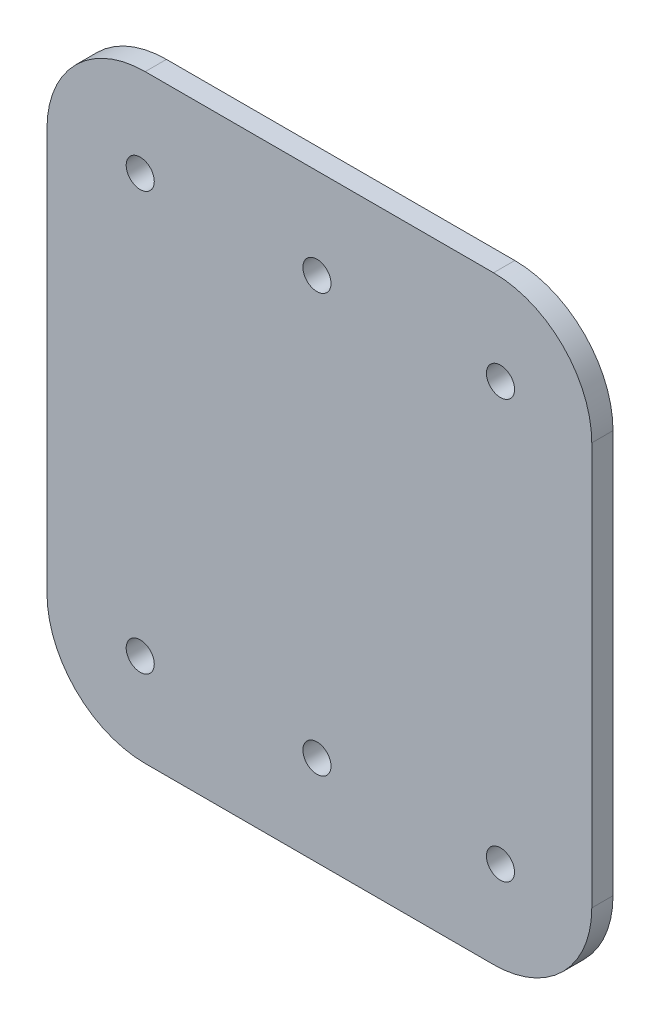
from build123d import *

# Parameters (mm, degrees)
SKETCH1_R           = 2.1
BOSS_EXTRUDE1_DEPTH = 3.175


with BuildPart() as part:
    # Sketch1 → Boss-Extrude1 (new body)
    with BuildSketch(Plane.XY):
        with BuildLine():
            Line((11.353799985, 133.984994751), (11.353799985, 73.787000793))
            ThreePointArc((11.353799985, 73.787000793), (15.653823909, 63.405824718), (26.034999985, 59.105800793))
            Line((26.034999985, 59.105800793), (78.104997498, 59.105800793))
            ThreePointArc((78.104997498, 59.105800793), (88.486173574, 63.405824718), (92.786197498, 73.787000793))
            Line((92.786197498, 73.787000793), (92.786197498, 133.984994751))
            ThreePointArc((92.786197498, 133.984994751), (88.486173574, 144.366170827), (78.104997498, 148.666194751))
            Line((78.104997498, 148.666194751), (26.034999985, 148.666194751))
            ThreePointArc((26.034999985, 148.666194751), (15.653823909, 144.366170827), (11.353799985, 133.984994751))
        make_face()
        with Locations((25.292, 135.128)):
            Circle(SKETCH1_R, mode=Mode.SUBTRACT)
        with Locations((51.708, 135.128)):
            Circle(SKETCH1_R, mode=Mode.SUBTRACT)
        with Locations((79.14, 135.128)):
            Circle(SKETCH1_R, mode=Mode.SUBTRACT)
        with Locations((79.14, 72.644)):
            Circle(SKETCH1_R, mode=Mode.SUBTRACT)
        with Locations((51.708, 72.644)):
            Circle(SKETCH1_R, mode=Mode.SUBTRACT)
        with Locations((25.292, 72.644)):
            Circle(SKETCH1_R, mode=Mode.SUBTRACT)
    extrude(amount=BOSS_EXTRUDE1_DEPTH)


solid = part.part
